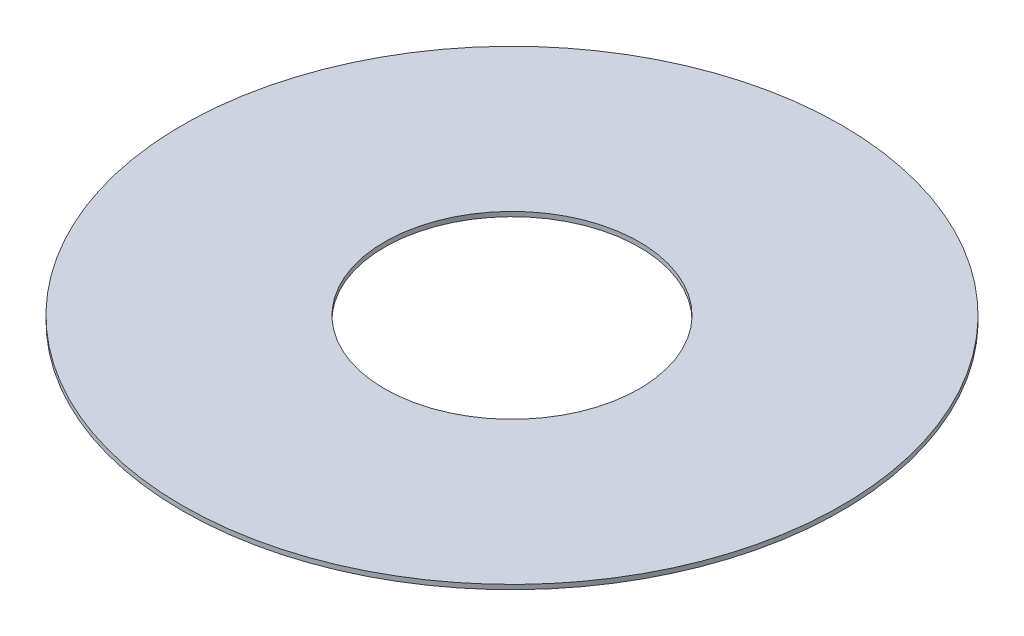
from build123d import *

# Parameters (mm, degrees)
SKETCH1_R           = 32.8676
SKETCH1_R_2         = 12.7
BOSS_EXTRUDE1_DEPTH = 0.4572


with BuildPart() as part:
    # Sketch1 → Boss-Extrude1 (new body)
    with BuildSketch(Plane(origin=(0, 0, 0), x_dir=(1, 0, 0), z_dir=(0, 1, 0))):
        with Locations(Location((0, 0, 0), (0, 0, 270))):
            Circle(SKETCH1_R)
        with Locations(Location((0, 0, 0), (0, 0, 270))):
            Circle(SKETCH1_R_2, mode=Mode.SUBTRACT)
    extrude(amount=BOSS_EXTRUDE1_DEPTH)


solid = part.part
